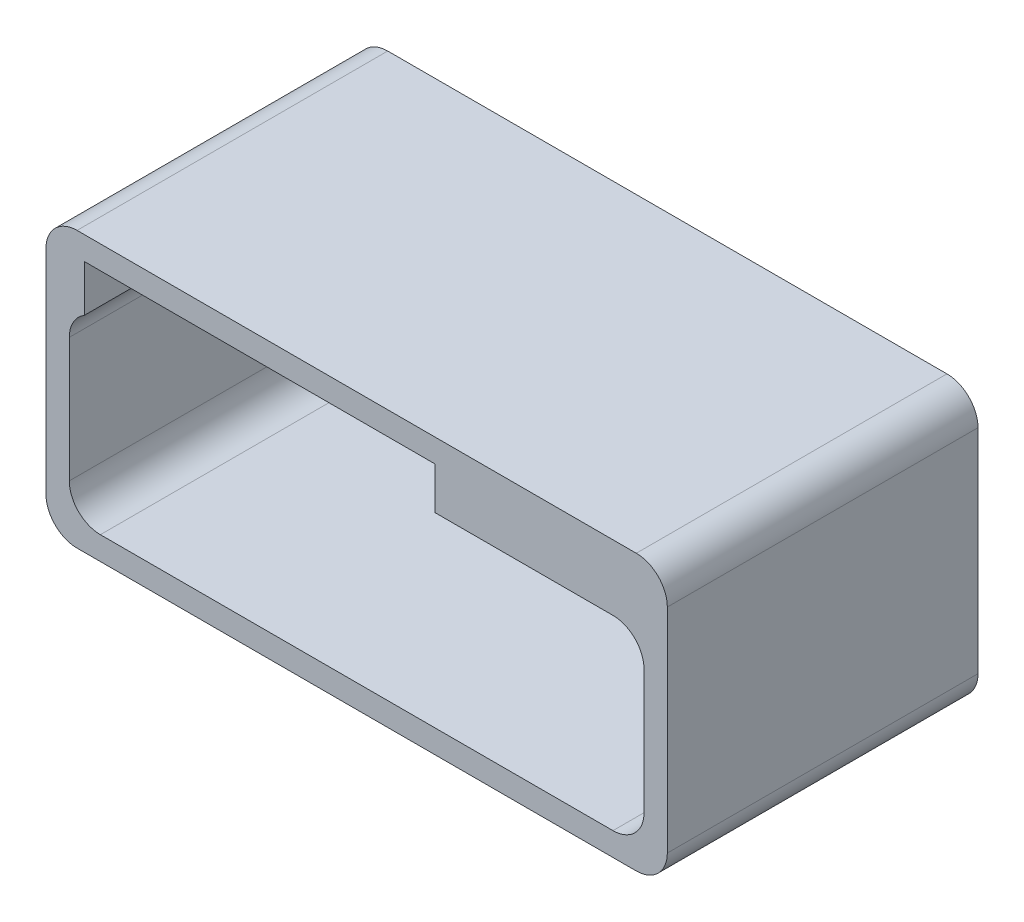
from build123d import *

# Parameters (mm, degrees)
BOSS_EXTRUDE1_DEPTH = 40


with BuildPart() as part:
    # Sketch1 → Boss-Extrude1 (new body)
    with BuildSketch(Plane.XY):
        with BuildLine():
            Line((-11.613277084, 21.495789474), (60.386722916, 21.495789474))
            ThreePointArc((60.386722916, 21.495789474), (63.21515004, 20.324216598), (64.386722916, 17.495789474))
            Line((64.386722916, 17.495789474), (64.386722916, -9.934210526))
            ThreePointArc((64.386722916, -9.934210526), (63.21515004, -12.762637651), (60.386722916, -13.934210526))
            Line((60.386722916, -13.934210526), (-11.613277084, -13.934210526))
            ThreePointArc((-11.613277084, -13.934210526), (-14.441704209, -12.762637651), (-15.613277084, -9.934210526))
            Line((-15.613277084, -9.934210526), (-15.613277084, 17.495789474))
            ThreePointArc((-15.613277084, 17.495789474), (-14.441704209, 20.324216598), (-11.613277084, 21.495789474))
        make_face()
        with BuildLine():
            Line((-10.673277084, 18.495789474), (34.456722916, 18.495789474))
            Line((34.456722916, 18.495789474), (34.456722916, 13.065789474))
            Line((34.456722916, 13.065789474), (57.386722916, 13.065789474))
            ThreePointArc((57.386722916, 13.065789474), (60.21515004, 11.894216598), (61.386722916, 9.065789474))
            Line((61.386722916, 9.065789474), (61.386722916, -6.934210526))
            ThreePointArc((61.386722916, -6.934210526), (60.21515004, -9.762637651), (57.386722916, -10.934210526))
            Line((57.386722916, -10.934210526), (-8.613277084, -10.934210526))
            ThreePointArc((-8.613277084, -10.934210526), (-11.441704209, -9.762637651), (-12.613277084, -6.934210526))
            Line((-12.613277084, -6.934210526), (-12.613277084, 9.065789474))
            ThreePointArc((-12.613277084, 9.065789474), (-12.094656121, 11.035561034), (-10.673277084, 12.494550183))
            Line((-10.673277084, 12.494550183), (-10.673277084, 13.065789474))
            Line((-10.673277084, 13.065789474), (-10.673277084, 18.495789474))
        make_face(mode=Mode.SUBTRACT)
    extrude(amount=BOSS_EXTRUDE1_DEPTH)


solid = part.part
